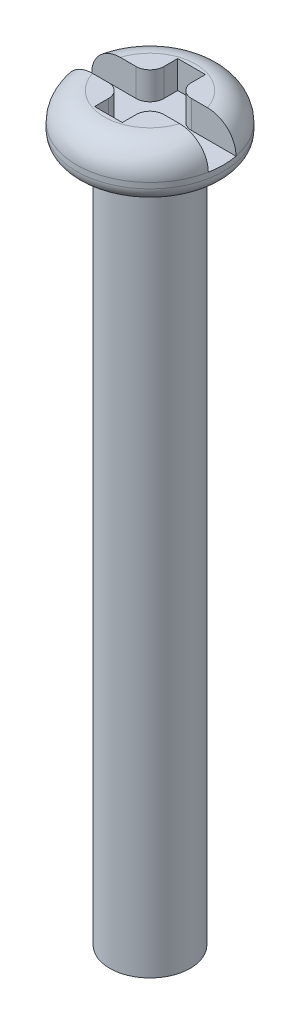
from build123d import *

# Parameters (mm, degrees)
SKETCH_1_R          = 1.45
EXTRUDE_1_DEPTH     = 25
SKETCH_2_R          = 2.65
EXTRUDE_2_DEPTH     = 1.7
CUT_EXTRUDE_START   = -1
SKETCH_3_W          = 1
SKETCH_3_H          = 1
CUT_EXTRUDE_1_DEPTH = 1
FILLET_1_R          = 0.5
FILLET_2_R          = 1
FILLET_3_R          = 0.5


with BuildPart() as part:
    # 草图1 → 凸台-拉伸1 (new body)
    with BuildSketch(Plane(origin=(0, 0, 0), x_dir=(1, 0, 0), z_dir=(0, 1, 0))):
        with Locations(Location((0, 0, 0), (0, 0, 270))):
            Circle(SKETCH_1_R)
    extrude(amount=EXTRUDE_1_DEPTH)

    # 草图2 → 凸台-拉伸2 (add)
    with BuildSketch(Plane(origin=(0, 25, 0), x_dir=(1, 0, 0), z_dir=(0, 1, 0))):
        with Locations(Location((0, 0, 0), (0, 0, 270))):
            Circle(SKETCH_2_R)
    extrude(amount=EXTRUDE_2_DEPTH)

    # 草图3 → 切除-拉伸1 (cut)
    with BuildSketch(Plane(origin=(0, 26.7, 0), x_dir=(1, 0, 0), z_dir=(0, 1, 0)).offset(CUT_EXTRUDE_START)):
        with BuildLine():
            Line((-0.5, 0.5), (-2.602402736, 0.5))
            ThreePointArc((-2.602402736, 0.5), (-2.65, 0), (-2.602402736, -0.5))
            Line((-2.602402736, -0.5), (-0.5, -0.5))
            Line((-0.5, -0.5), (-0.5, 0.5))
        make_face()
        with Locations((0, 1)):
            Rectangle(SKETCH_3_W, SKETCH_3_H)
        Rectangle(SKETCH_3_W, SKETCH_3_H)
        with Locations((0, -1)):
            Rectangle(SKETCH_3_W, SKETCH_3_H)
        with BuildLine():
            ThreePointArc((2.65, 0), (2.638073848, 0.251130195), (2.602402736, 0.5))
            Line((2.602402736, 0.5), (0.5, 0.5))
            Line((0.5, 0.5), (0.5, -0.5))
            Line((0.5, -0.5), (2.602402736, -0.5))
            ThreePointArc((2.602402736, -0.5), (2.638073848, -0.251130195), (2.65, 0))
        make_face()
    extrude(amount=CUT_EXTRUDE_1_DEPTH, mode=Mode.SUBTRACT)

    # 圆角1
    fillet_1_edges = [part.edges().sort_by_distance(p)[0] for p in [
        (-0.5, 26.2, 0.5),
        (-0.5, 26.2, -0.5),
        (0.5, 26.2, -0.5),
        (0.5, 26.2, 0.5),
    ]]
    fillet(fillet_1_edges, radius=FILLET_1_R)

    # 圆角2
    fillet_2_edges = [part.edges().sort_by_distance(p)[0] for p in [
        (0, 26.7, -2.65),
        (1.687824043, 26.7, 2.042975771),
    ]]
    fillet(fillet_2_edges, radius=FILLET_2_R)

    # 圆角3
    fillet_3_edges = [part.edges().sort_by_distance(p)[0] for p in [
        (0, 25, -2.65),
    ]]
    fillet(fillet_3_edges, radius=FILLET_3_R)


solid = part.part
